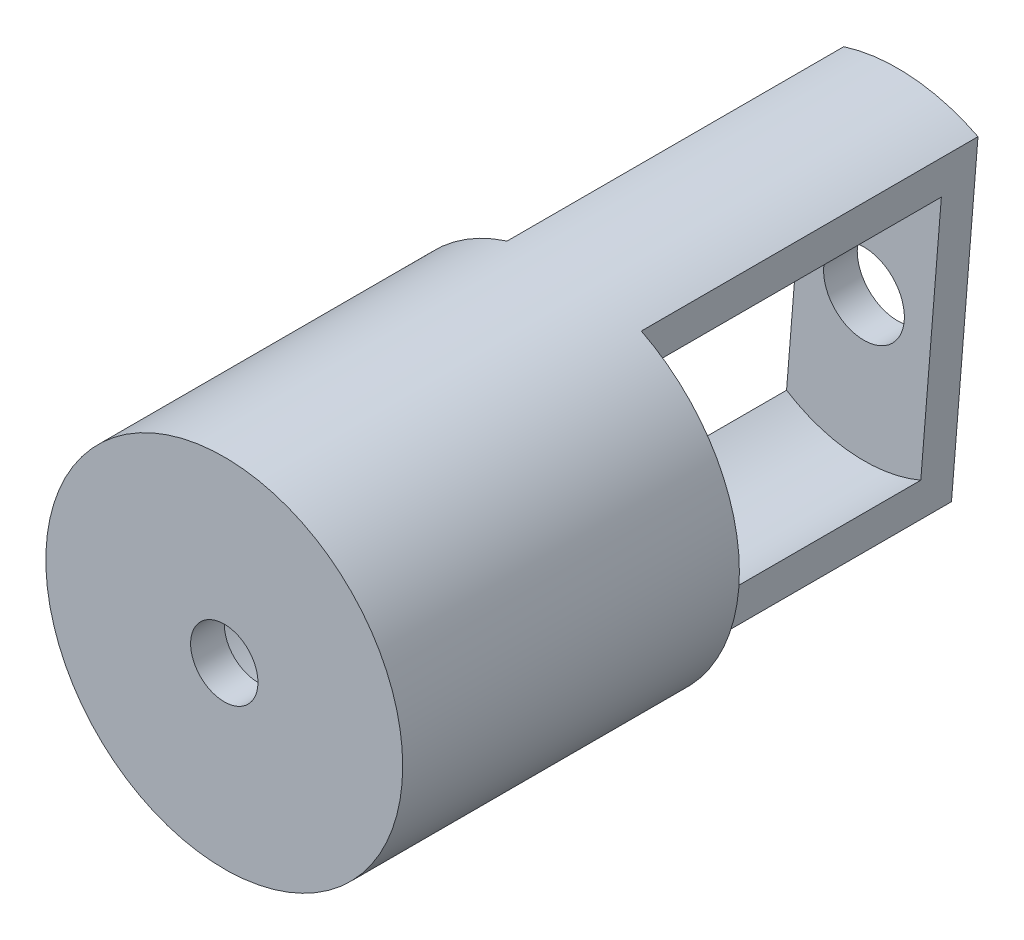
from build123d import *

# Parameters (mm, degrees)
SKETCH1_R           = 21.5
SKETCH1_R_2         = 5
BOSS_EXTRUDE1_DEPTH = 5
EXTRUDE_THIN1_START = -100
SKETCH2_R           = 26.5
SKETCH2_R_2         = 21.5
EXTRUDE_THIN1_DEPTH = 100
CUT_EXTRUDE1_DEPTH  = 50
BOSS_EXTRUDE2_DEPTH = 5
SKETCH5_R           = 6
CUT_EXTRUDE2_DEPTH  = 5


with BuildPart() as part:
    # Sketch1 → Boss-Extrude1 (new body)
    with BuildSketch(Plane.XY):
        Circle(SKETCH1_R)
        Circle(SKETCH1_R_2, mode=Mode.SUBTRACT)
    extrude(amount=BOSS_EXTRUDE1_DEPTH)

    # Sketch2 → Extrude-Thin1 (add)
    with BuildSketch(Plane.XY.offset(5).offset(EXTRUDE_THIN1_START)):
        Circle(SKETCH2_R)
        Circle(SKETCH2_R_2, mode=Mode.SUBTRACT)
    extrude(amount=EXTRUDE_THIN1_DEPTH)

    # Sketch3 → Cut-Extrude1 (cut)
    with BuildSketch(Plane(origin=(0, 0, -95), x_dir=(-1, 0, 0), z_dir=(0, 0, -1))):
        with BuildLine():
            Line((11.936744149, -23.659335137), (11.494827009, -18.169175876))
            ThreePointArc((11.494827009, -18.169175876), (21.430686769, 1.725011487), (8.440695566, 19.773837725))
            Line((8.440695566, 19.773837725), (7.998778427, 25.263996985))
            ThreePointArc((7.998778427, 25.263996985), (26.414567412, 2.126176949), (11.936744149, -23.659335137))
        make_face()
        with BuildLine():
            Line((-11.494827009, 18.169175876), (-11.936744149, 23.659335137))
            ThreePointArc((-11.936744149, 23.659335137), (-26.414567412, -2.126176949), (-7.998778427, -25.263996985))
            Line((-7.998778427, -25.263996985), (-8.440695566, -19.773837725))
            ThreePointArc((-8.440695566, -19.773837725), (-21.430686769, -1.725011487), (-11.494827009, 18.169175876))
        make_face()
    extrude(amount=-CUT_EXTRUDE1_DEPTH, mode=Mode.SUBTRACT)

    # Sketch4 → Boss-Extrude2 (add)
    with BuildSketch(Plane(origin=(0, 0, -95), x_dir=(-1, 0, 0), z_dir=(0, 0, -1))):
        with BuildLine():
            Line((-11.494827009, 18.169175876), (-8.440695566, -19.773837725))
            ThreePointArc((-8.440695566, -19.773837725), (1.725011487, -21.430686769), (11.494827009, -18.169175876))
            Line((11.494827009, -18.169175876), (8.440695566, 19.773837725))
            ThreePointArc((8.440695566, 19.773837725), (-1.725011487, 21.430686769), (-11.494827009, 18.169175876))
        make_face()
    extrude(amount=-BOSS_EXTRUDE2_DEPTH)

    # Sketch5 → Cut-Extrude2 (cut)
    with BuildSketch(Plane(origin=(0, 0, -95), x_dir=(-1, 0, 0), z_dir=(0, 0, -1))):
        Circle(SKETCH5_R)
    extrude(amount=-CUT_EXTRUDE2_DEPTH, mode=Mode.SUBTRACT)


solid = part.part
